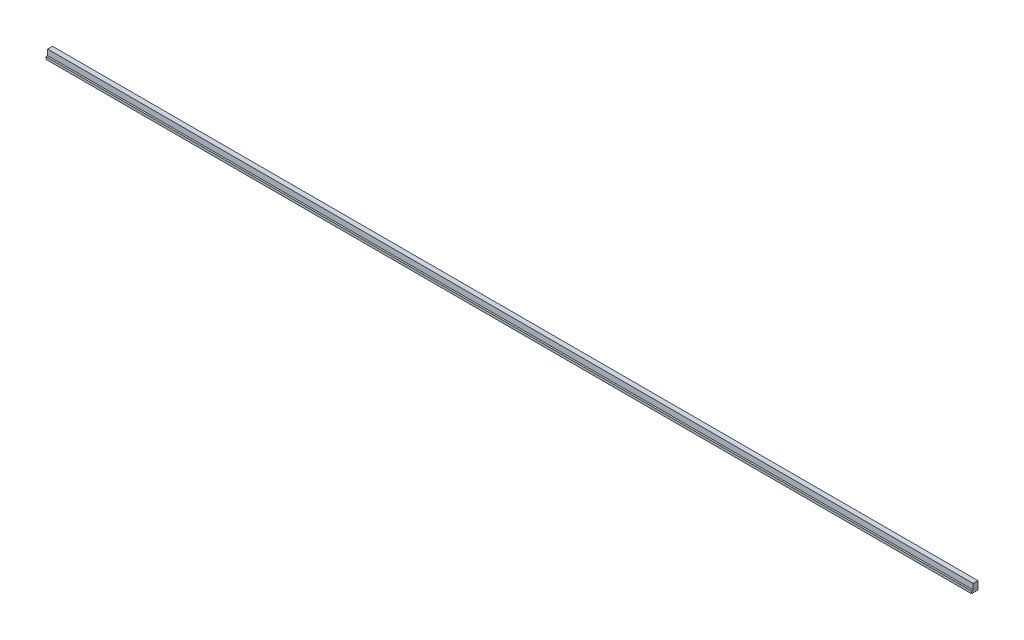
from build123d import *

# Parameters (mm, degrees)
SKETCH_1_W      = 5700
SKETCH_1_H      = 50
EXTRUDE_1_DEPTH = 15
SKETCH_3_W      = 5700
SKETCH_3_H      = 15
EXTRUDE_3_DEPTH = 10


with BuildPart() as part:
    # 草图1 → 凸台-拉伸1 (new, symmetric)
    with BuildSketch(Plane.XY):
        Rectangle(SKETCH_1_W, SKETCH_1_H)
    extrude(amount=EXTRUDE_1_DEPTH, both=True)

    # 草图3 → 凸台-拉伸3 (add)
    with BuildSketch(Plane.XY.offset(15)):
        with Locations((0, -17.5)):
            Rectangle(SKETCH_3_W, SKETCH_3_H)
    extrude(amount=EXTRUDE_3_DEPTH)


solid = part.part
